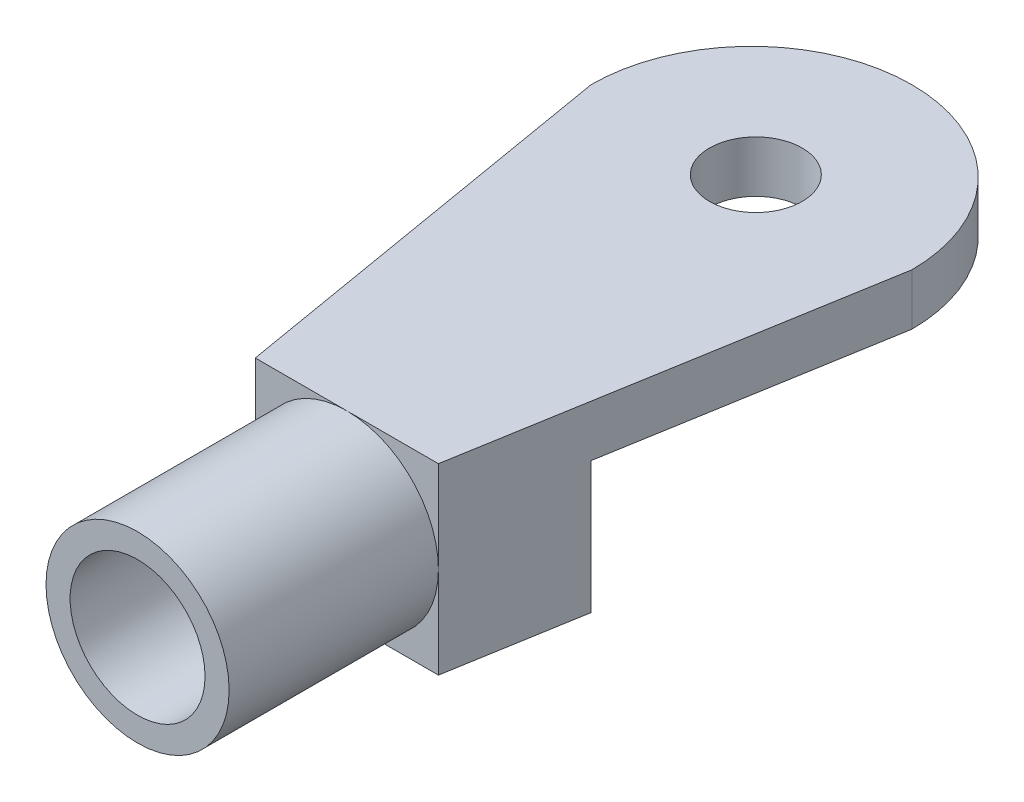
from build123d import *

# Parameters (mm, degrees)
SKETCH1_R           = 4.445
SKETCH1_R_2         = 3.275000003
BOSS_EXTRUDE1_DEPTH = 10.16
SKETCH2_W           = 8.89
SKETCH2_H           = 8.89
BOSS_EXTRUDE2_DEPTH = 25.4
BOSS_EXTRUDE3_REACH = 29.275
SKETCH9_R           = 2.2499955
CUT_EXTRUDE1_DEPTH  = 30.863820986
SKETCH11_R          = 2.2499955
CUT_EXTRUDE4_DEPTH  = 6.38999992


with BuildPart() as part:
    # Sketch1 → Boss-Extrude1 (new body)
    with BuildSketch(Plane.XY):
        Circle(SKETCH1_R)
        Circle(SKETCH1_R_2, mode=Mode.SUBTRACT)
    extrude(amount=BOSS_EXTRUDE1_DEPTH)

    # Sketch2 → Boss-Extrude2 (add)
    with BuildSketch(Plane(origin=(0, 0, 0), x_dir=(-1, 0, 0), z_dir=(0, 0, -1))):
        Rectangle(SKETCH2_W, SKETCH2_H)
    extrude(amount=BOSS_EXTRUDE2_DEPTH)

    # Boss-Extrude3: up to this face of the body (flat: up to its plane)
    boss_extrude3_end = Plane(part.part.faces().sort_by_distance((0, 4.445, -12.7))[0])
    # Sketch8 → Boss-Extrude3 (add, up to the picked face)
    with BuildSketch(Plane(origin=(0, -4.445, 0), x_dir=(-1, 0, 0), z_dir=(0, -1, 0)), mode=Mode.PRIVATE) as boss_extrude3_sk1:
        with BuildLine():
            Line((7.784941034, 19.641513294), (4.445, 0))
            Line((4.445, 0), (-4.445, 0))
            Line((-4.445, 0), (-7.784941034, 19.641513294))
            ThreePointArc((-7.784941034, 19.641513294), (0, 27.426454328), (7.784941034, 19.641513294))
        make_face()
    boss_extrude3_tool1 = split(extrude(boss_extrude3_sk1.sketch, amount=-BOSS_EXTRUDE3_REACH, mode=Mode.PRIVATE), bisect_by=boss_extrude3_end, keep=Keep.BOTH, mode=Mode.PRIVATE)
    add(boss_extrude3_tool1.solids().sort_by(Axis((0, -4.445, -14.186159), (0, 1, 0)))[0])

    # Sketch9 → Cut-Extrude1 (cut, through all)
    with BuildSketch(Plane(origin=(0, 4.445, 0), x_dir=(1, 0, 0), z_dir=(0, 1, 0))):
        with Locations(Location((0, 19.853346126, 0), (0, 0, 180))):
            Circle(SKETCH9_R)
    extrude(amount=-CUT_EXTRUDE1_DEPTH, mode=Mode.SUBTRACT)

    # Sketch11 → Cut-Extrude4 (cut)
    with BuildSketch(Plane.XZ.offset(4.445)):
        with BuildLine():
            Line((5.521223684, -6.329052393), (-5.521223684, -6.329052393))
            Line((-5.521223684, -6.329052393), (-7.784941034, -19.641513294))
            ThreePointArc((-7.784941034, -19.641513294), (0, -27.426454328), (7.784941034, -19.641513294))
            Line((7.784941034, -19.641513294), (5.521223684, -6.329052393))
        make_face()
        with Locations(Location((0, -19.853346126, 0), (0, 0, 180))):
            Circle(SKETCH11_R, mode=Mode.SUBTRACT)
    extrude(amount=-CUT_EXTRUDE4_DEPTH, mode=Mode.SUBTRACT)


solid = part.part
